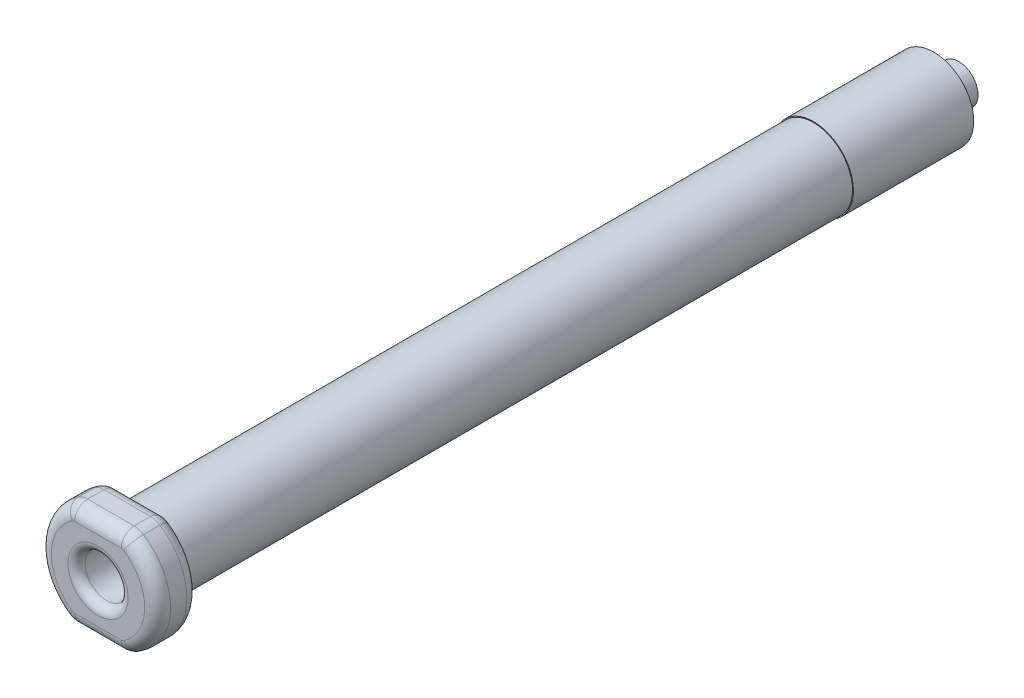
from build123d import *

# Parameters (mm, degrees)
SKETCH1_R           = 4.55
BOSS_EXTRUDE1_DEPTH = 83.25
BOSS_EXTRUDE2_DEPTH = 4.9
SKETCH3_R           = 4.65
BOSS_EXTRUDE3_DEPTH = 14
SKETCH4_R           = 4.5
CUT_EXTRUDE1_DEPTH  = 14
SKETCH5_R           = 2.25
BOSS_EXTRUDE4_DEPTH = 16.9
SKETCH6_R           = 0.875
CUT_EXTRUDE2_DEPTH  = 16.9
SKETCH7_R           = 2.5
CUT_EXTRUDE3_DEPTH  = 83.25
FILLET4_R           = 2
FILLET5_R           = 1.5
FILLET6_R           = 1.5
FILLET7_R           = 1


with BuildPart() as part:
    # Sketch1 → Boss-Extrude1 (new body)
    with BuildSketch(Plane.XY):
        Circle(SKETCH1_R)
    extrude(amount=BOSS_EXTRUDE1_DEPTH)

    # Sketch2 → Boss-Extrude2 (add)
    with BuildSketch(Plane.XY.offset(83.25)):
        with BuildLine():
            Line((-3.25, 6.125), (3.25, 6.125))
            ThreePointArc((3.25, 6.125), (6.933839124, 0), (3.25, -6.125))
            Line((3.25, -6.125), (-3.25, -6.125))
            ThreePointArc((-3.25, -6.125), (-6.933839124, 0), (-3.25, 6.125))
        make_face()
    extrude(amount=-BOSS_EXTRUDE2_DEPTH)

    # Sketch3 → Boss-Extrude3 (add)
    with BuildSketch(Plane(origin=(0, 0, 0), x_dir=(-1, 0, 0), z_dir=(0, 0, -1))):
        Circle(SKETCH3_R)
    extrude(amount=BOSS_EXTRUDE3_DEPTH)

    # Sketch4 → Cut-Extrude1 (cut)
    with BuildSketch(Plane(origin=(0, 0, -14), x_dir=(-1, 0, 0), z_dir=(0, 0, -1))):
        Circle(SKETCH4_R)
    extrude(amount=-CUT_EXTRUDE1_DEPTH, mode=Mode.SUBTRACT)

    # Sketch5 → Boss-Extrude4 (add)
    with BuildSketch(Plane(origin=(0, 0, 0), x_dir=(-1, 0, 0), z_dir=(0, 0, -1))):
        Circle(SKETCH5_R)
    extrude(amount=BOSS_EXTRUDE4_DEPTH)

    # Sketch6 → Cut-Extrude2 (cut)
    with BuildSketch(Plane(origin=(0, 0, -16.9), x_dir=(-1, 0, 0), z_dir=(0, 0, -1))):
        Circle(SKETCH6_R)
    extrude(amount=-CUT_EXTRUDE2_DEPTH, mode=Mode.SUBTRACT)

    # Sketch7 → Cut-Extrude3 (cut)
    with BuildSketch(Plane.XY.offset(83.25)):
        Circle(SKETCH7_R)
    extrude(amount=-CUT_EXTRUDE3_DEPTH, mode=Mode.SUBTRACT)


with BuildPart() as cut_extrude3_piece_1:
    # of the separate pieces the step leaves, piece 1, a body of its own (cut_extrude3_pieces)
    add(part.part.solids().sort_by_distance((-4.65, 0, 0))[0])

    # Fillet4
    fillet4_edges = [cut_extrude3_piece_1.edges().sort_by_distance(p)[0] for p in [
        (-3.25, -6.125, 80.8),
        (-3.25, 6.125, 80.8),
        (3.25, 6.125, 80.8),
        (3.25, -6.125, 80.8),
    ]]
    fillet(fillet4_edges, radius=FILLET4_R)

    # Fillet5
    fillet5_edges = [cut_extrude3_piece_1.edges().sort_by_distance(p)[0] for p in [
        (-6.933839124, 0, 83.25),
        (0, -6.125, 83.25),
        (6.933839124, 0, 83.25),
        (0, 6.125, 83.25),
        (-3.279472637, 6.041279171, 83.25),
        (3.279472637, 6.041279171, 83.25),
        (3.279472637, -6.041279171, 83.25),
        (-3.279472637, -6.041279171, 83.25),
    ]]
    fillet(fillet5_edges, radius=FILLET5_R)

    # Fillet6
    fillet6_edges = [cut_extrude3_piece_1.edges().sort_by_distance(p)[0] for p in [
        (-6.933839124, 0, 78.35),
        (0, -6.125, 78.35),
        (0, 6.125, 78.35),
        (6.933839124, 0, 78.35),
        (-3.279472637, 6.041279171, 78.35),
        (3.279472637, 6.041279171, 78.35),
        (3.279472637, -6.041279171, 78.35),
        (-3.279472637, -6.041279171, 78.35),
    ]]
    fillet(fillet6_edges, radius=FILLET6_R)

    # Fillet7
    fillet7_edges = [cut_extrude3_piece_1.edges().sort_by_distance(p)[0] for p in [
        (-2.5, 0, 83.25),
    ]]
    fillet(fillet7_edges, radius=FILLET7_R)


with BuildPart() as cut_extrude3_piece_2:
    # of the separate pieces the step leaves, piece 2, a body of its own (cut_extrude3_pieces)
    add(part.part.solids().sort_by_distance((-2.25, 0, 0))[0])


solid = Compound([cut_extrude3_piece_1.part, cut_extrude3_piece_2.part])
